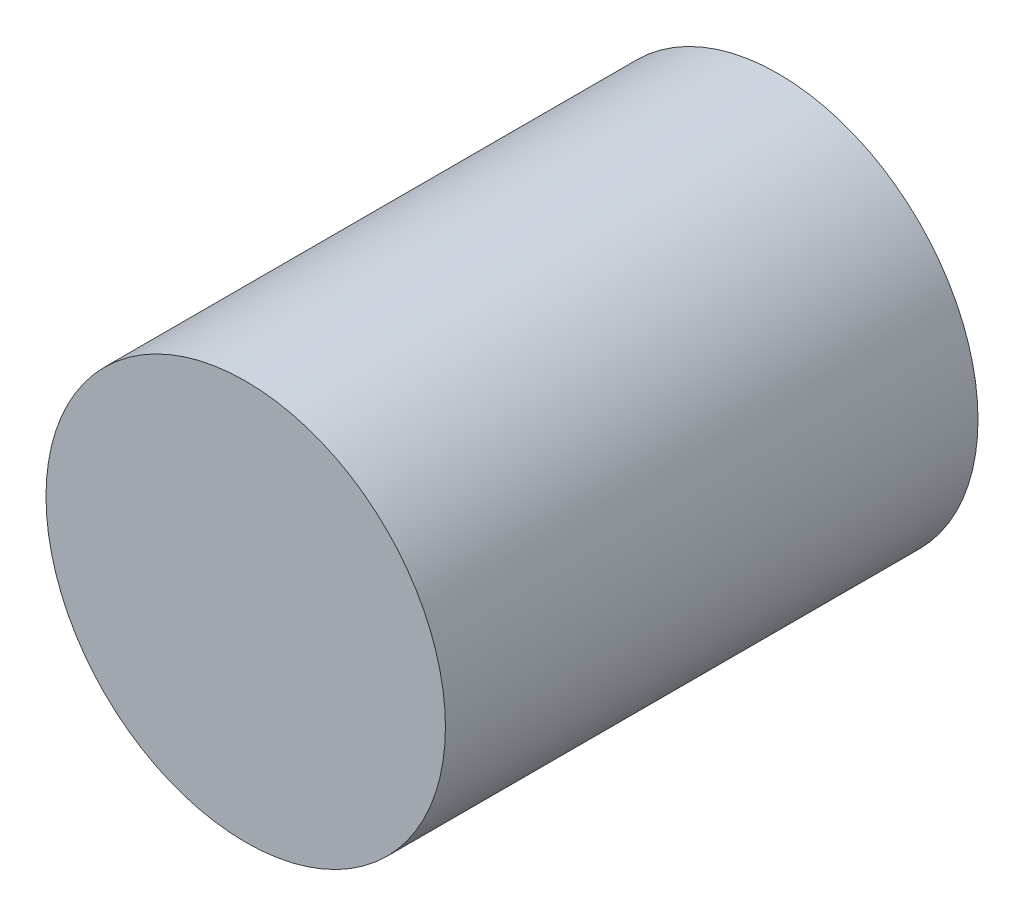
from build123d import *

# Parameters (mm, degrees)
SKETCH1_R           = 7.5
BOSS_EXTRUDE1_DEPTH = 20


with BuildPart() as part:
    # Sketch1 → Boss-Extrude1 (new body)
    with BuildSketch(Plane.XY):
        Circle(SKETCH1_R)
    extrude(amount=BOSS_EXTRUDE1_DEPTH)


solid = part.part
